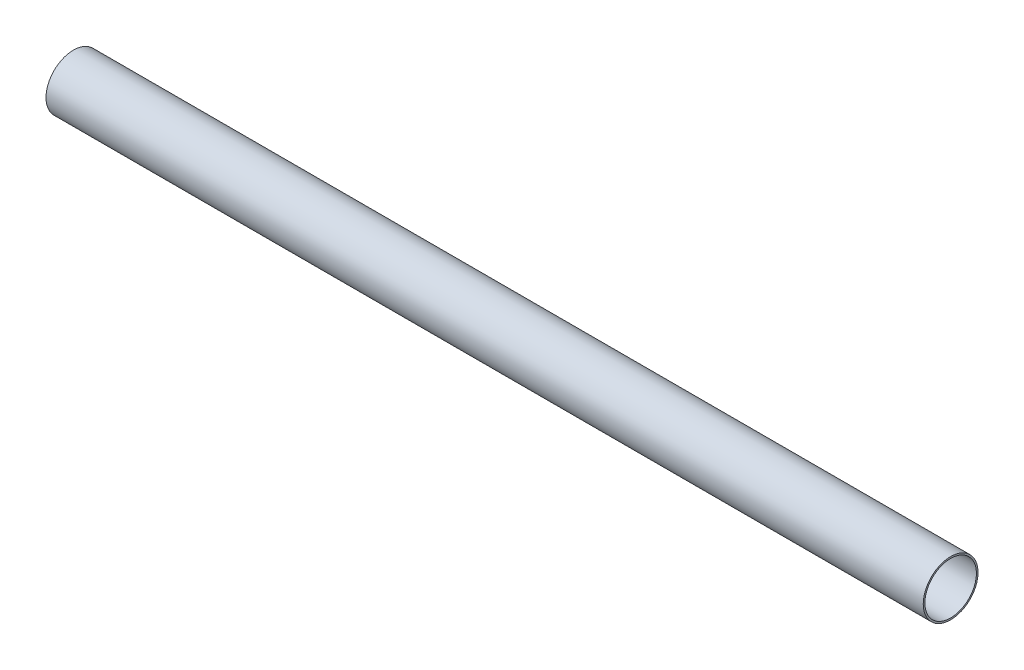
from build123d import *

# Parameters (mm, degrees)
ESQUISSE1_W = 80
ESQUISSE1_H = 0.15


with BuildPart() as part:
    # Esquisse1 → Révolution1 (revolve)
    with BuildSketch(Plane.XY, mode=Mode.PRIVATE) as r_volution1_sk:
        with Locations((-15, 2.425)):
            Rectangle(ESQUISSE1_W, ESQUISSE1_H)
    revolve(r_volution1_sk.sketch.rotate(Axis((-151.415188976, 0, 0), (1, 0, 0)), 90), axis=Axis((-151.415188976, 0, 0), (1, 0, 0)))


solid = part.part
